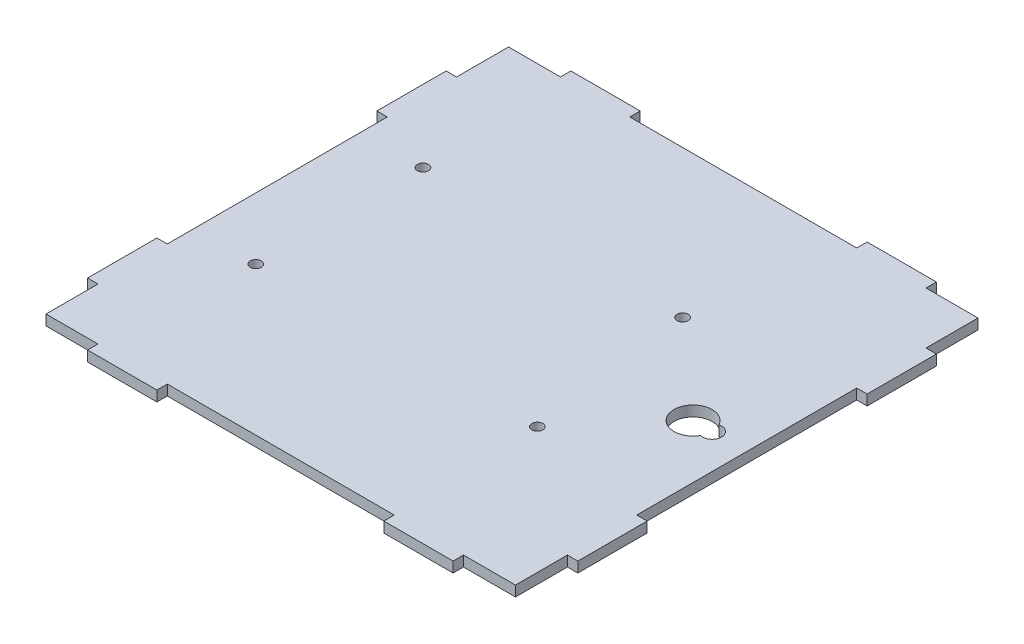
from build123d import *

# Parameters (mm, degrees)
SKETCH1_W           = 135.499999433
SKETCH1_H           = 133.500000387
BOSS_EXTRUDE1_DEPTH = 3
SKETCH2_W           = 3
SKETCH2_H           = 20
SKETCH2_W_2         = 20
SKETCH2_H_2         = 3
BOSS_EXTRUDE2_DEPTH = 3
SKETCH3_R           = 1.6
CUT_EXTRUDE1_DEPTH  = 115.913475286
SKETCH4_R           = 5.5
SKETCH4_R_2         = 2.75
CUT_EXTRUDE2_DEPTH  = 115.913475286


with BuildPart() as part:
    # Sketch1 → Boss-Extrude1 (new body)
    with BuildSketch(Plane(origin=(0, 0, 0), x_dir=(1, 0, 0), z_dir=(0, 1, 0))):
        with Locations((16.289033152, -5.21875036)):
            Rectangle(SKETCH1_W, SKETCH1_H)
    extrude(amount=BOSS_EXTRUDE1_DEPTH)

    # Sketch2 → Boss-Extrude2 (add, through all)
    with BuildSketch(Plane(origin=(0, 3, 0), x_dir=(1, 0, 0), z_dir=(0, 1, 0))):
        with Locations((85.539032868, 36.531249834)):
            Rectangle(SKETCH2_W, SKETCH2_H)
        with Locations((85.539032868, -46.968750553)):
            Rectangle(SKETCH2_W, SKETCH2_H)
        with Locations((59.039032868, 63.031249834)):
            Rectangle(SKETCH2_W_2, SKETCH2_H_2)
        with Locations((-26.460966565, 63.031249834)):
            Rectangle(SKETCH2_W_2, SKETCH2_H_2)
        with Locations((-52.960966565, 36.531249834)):
            Rectangle(SKETCH2_W, SKETCH2_H)
        with Locations((-52.960966565, -46.968750553)):
            Rectangle(SKETCH2_W, SKETCH2_H)
        with Locations((-26.460966565, -73.468750553)):
            Rectangle(SKETCH2_W_2, SKETCH2_H_2)
        with Locations((59.039032868, -73.468750553)):
            Rectangle(SKETCH2_W_2, SKETCH2_H_2)
    extrude(amount=-BOSS_EXTRUDE2_DEPTH)

    # Sketch3 → Cut-Extrude1 (cut, through all)
    with BuildSketch(Plane.XZ):
        with Locations(Location((-33.660968451, 29.22874915, 0), (0, 0, 270))):
            Circle(SKETCH3_R)
        with Locations(Location((47.619031549, 29.22874915, 0), (0, 0, 270))):
            Circle(SKETCH3_R)
        with Locations(Location((41.269031549, -19.03125085, 0), (0, 0, 270))):
            Circle(SKETCH3_R)
        with Locations(Location((-33.660968451, -19.03125085, 0), (0, 0, 270))):
            Circle(SKETCH3_R)
    extrude(amount=-CUT_EXTRUDE1_DEPTH, mode=Mode.SUBTRACT)

    # Sketch4 → Cut-Extrude2 (cut, through all)
    with BuildSketch(Plane.XZ):
        with Locations((68.539032868, 5.21875036)):
            Circle(SKETCH4_R)
        with Locations((74.039032868, 5.21875036)):
            Circle(SKETCH4_R_2)
    extrude(amount=-CUT_EXTRUDE2_DEPTH, mode=Mode.SUBTRACT)


solid = part.part
